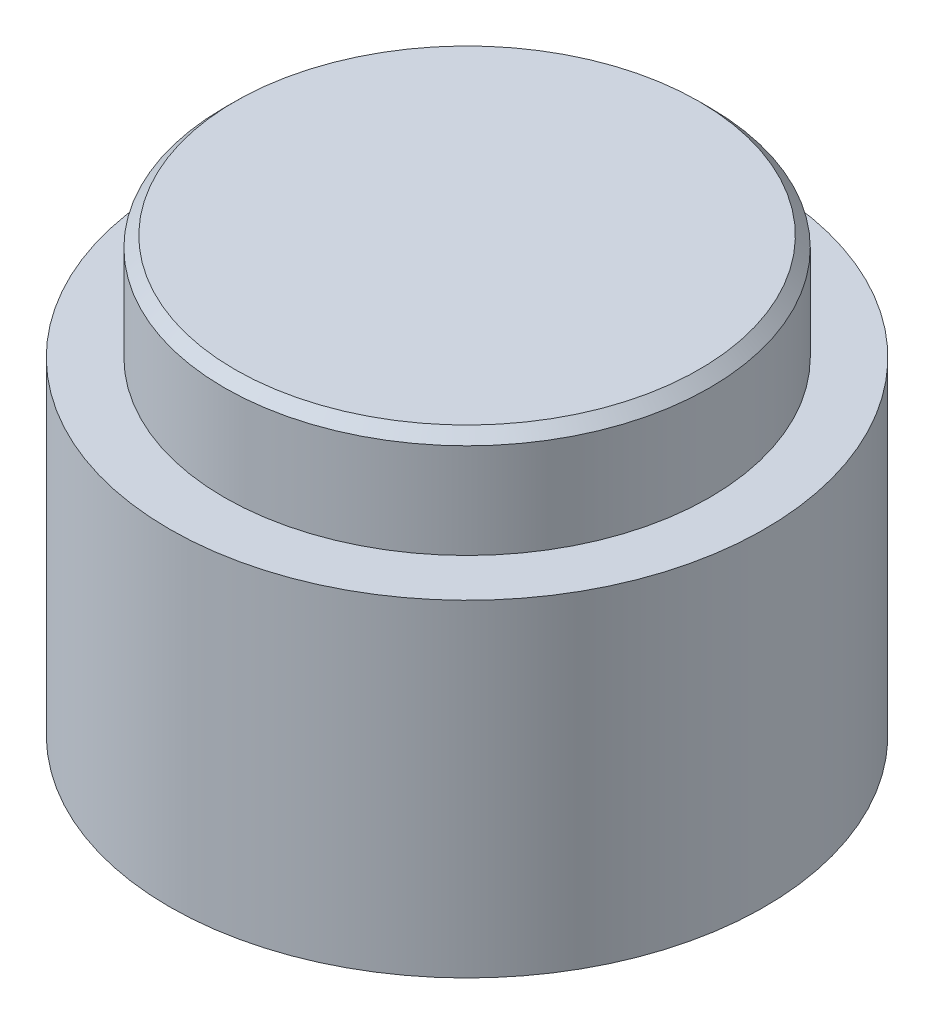
from build123d import *

# Parameters (mm, degrees)
SKETCH1_R      = 14.1
EXTRUDE1_DEPTH = 15.5
SKETCH2_R      = 11.5
EXTRUDE2_DEPTH = 5
CHAMFER1_SIZE  = 0.5
SKETCH3_R      = 11.617958336
EXTRUDE3_DEPTH = 3


with BuildPart() as part:
    # Sketch1 → Extrude1 (new body)
    with BuildSketch(Plane(origin=(0, 0, 0), x_dir=(1, 0, 0), z_dir=(0, 1, 0))):
        with Locations(Location((0, 0, 0), (0, 0, 270))):
            Circle(SKETCH1_R)
    extrude(amount=EXTRUDE1_DEPTH)

    # Sketch2 → Extrude2 (add)
    with BuildSketch(Plane(origin=(0, 15.5, 0), x_dir=(1, 0, 0), z_dir=(0, 1, 0))):
        with Locations(Location((0, 0, 0), (0, 0, 270))):
            Circle(SKETCH2_R)
    extrude(amount=EXTRUDE2_DEPTH)

    # Chamfer1
    chamfer1_edges = [part.edges().sort_by_distance(p)[0] for p in [
        (0, 20.5, -11.5),
    ]]
    chamfer(chamfer1_edges, length=CHAMFER1_SIZE)

    # Sketch3 → Extrude3 (cut)
    with BuildSketch(Plane.XZ):
        with Locations(Location((0, 0, 0), (0, 0, 270))):
            Circle(SKETCH3_R)
    extrude(amount=-EXTRUDE3_DEPTH, mode=Mode.SUBTRACT)


solid = part.part
